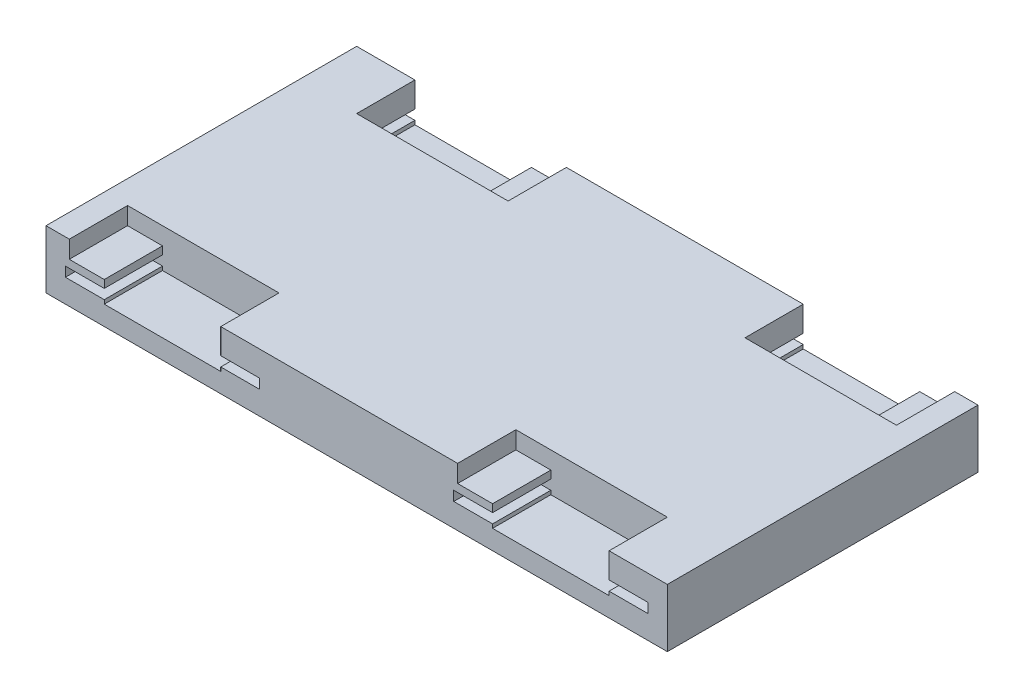
from build123d import *

# Parameters (mm, degrees)
SKETCH1_W               = 320
SKETCH1_H               = 160
BOSS_EXTRUDE1_DEPTH     = 20
SKETCH2_W               = 60
SKETCH2_H               = 30
CUT_EXTRUDE1_DEPTH      = 28
SKETCH3_W               = 20
SKETCH3_H               = 5
CUT_EXTRUDE3_DEPTH      = 30
MIRROR3_COPY_1_SKETCH_W = 60
MIRROR3_COPY_1_SKETCH_H = 30
MIRROR3_COPY_1_DEPTH    = 28
MIRROR3_COPY_2_SKETCH_W = 20
MIRROR3_COPY_2_SKETCH_H = 5
MIRROR3_COPY_2_DEPTH    = 30
SKETCH5_W               = 18
SKETCH5_H               = 9
CUT_EXTRUDE4_DEPTH      = 30
SKETCH6_W               = 18
SKETCH6_H               = 9
CUT_EXTRUDE5_DEPTH      = 30
SKETCH8_W               = 18
SKETCH8_H               = 9
CUT_EXTRUDE6_DEPTH      = 30
SKETCH9_W               = 18
SKETCH9_H               = 9
CUT_EXTRUDE7_DEPTH      = 30
SKETCH10_W              = 320
SKETCH10_H              = 160
BOSS_EXTRUDE2_DEPTH     = 10


with BuildPart() as part:
    # Sketch1 → Boss-Extrude1 (new body)
    with BuildSketch(Plane(origin=(0, 0, 0), x_dir=(1, 0, 0), z_dir=(0, 1, 0))):
        Rectangle(SKETCH1_W, SKETCH1_H)
    extrude(amount=BOSS_EXTRUDE1_DEPTH)

    # Sketch2 → Cut-Extrude1 (cut)
    with BuildSketch(Plane(origin=(0, 20, 0), x_dir=(1, 0, 0), z_dir=(0, 1, 0))):
        with Locations((-100, -65)):
            Rectangle(SKETCH2_W, SKETCH2_H)
    cut_extrude1 = extrude(amount=-CUT_EXTRUDE1_DEPTH, mode=Mode.SUBTRACT)

    # Sketch3 → Cut-Extrude3 (cut)
    with BuildSketch(Plane.XY.offset(80)):
        with Locations((-140, 4.5)):
            Rectangle(SKETCH3_W, SKETCH3_H)
        with Locations((-60, 4.5)):
            Rectangle(SKETCH3_W, SKETCH3_H)
    cut_extrude3 = extrude(amount=-CUT_EXTRUDE3_DEPTH, mode=Mode.SUBTRACT)

    # Mirror2: Cut-Extrude1, Cut-Extrude3 across plane
    add(cut_extrude1.mirror(Plane(origin=(0, 0, 0), x_dir=(0, 0, 1), z_dir=(1, 0, 0))), mode=Mode.SUBTRACT)
    add(cut_extrude3.mirror(Plane(origin=(0, 0, 0), x_dir=(0, 0, 1), z_dir=(1, 0, 0))), mode=Mode.SUBTRACT)

    # Mirror3: Cut-Extrude1, Cut-Extrude3 across plane
    add(cut_extrude1.mirror(Plane.XY), mode=Mode.SUBTRACT)
    add(cut_extrude3.mirror(Plane.XY), mode=Mode.SUBTRACT)

    # Mirror3 copy 1 sketch → Mirror3 copy 1 (cut)
    with BuildSketch(Plane(origin=(0, 20, 0), x_dir=(-1, 0, 0), z_dir=(0, 1, 0))):
        with Locations((-100, -65)):
            Rectangle(MIRROR3_COPY_1_SKETCH_W, MIRROR3_COPY_1_SKETCH_H)
    extrude(amount=-MIRROR3_COPY_1_DEPTH, mode=Mode.SUBTRACT)

    # Mirror3 copy 2 sketch → Mirror3 copy 2 (cut)
    with BuildSketch(Plane(origin=(0, 0, -80), x_dir=(-1, 0, 0), z_dir=(0, 0, -1))):
        with Locations((-140, 4.5)):
            Rectangle(MIRROR3_COPY_2_SKETCH_W, MIRROR3_COPY_2_SKETCH_H)
        with Locations((-60, 4.5)):
            Rectangle(MIRROR3_COPY_2_SKETCH_W, MIRROR3_COPY_2_SKETCH_H)
    extrude(amount=-MIRROR3_COPY_2_DEPTH, mode=Mode.SUBTRACT)

    # Sketch5 → Cut-Extrude4 (cut)
    with BuildSketch(Plane.XY.offset(80)):
        with Locations((-139, 15.5)):
            Rectangle(SKETCH5_W, SKETCH5_H)
    extrude(amount=-CUT_EXTRUDE4_DEPTH, mode=Mode.SUBTRACT)

    # Sketch6 → Cut-Extrude5 (cut)
    with BuildSketch(Plane.XY.offset(80)):
        with Locations((61, 15.5)):
            Rectangle(SKETCH6_W, SKETCH6_H)
    extrude(amount=-CUT_EXTRUDE5_DEPTH, mode=Mode.SUBTRACT)

    # Sketch8 → Cut-Extrude6 (cut)
    with BuildSketch(Plane(origin=(0, 0, -80), x_dir=(-1, 0, 0), z_dir=(0, 0, -1))):
        with Locations((-139, 15.5)):
            Rectangle(SKETCH8_W, SKETCH8_H)
    extrude(amount=-CUT_EXTRUDE6_DEPTH, mode=Mode.SUBTRACT)

    # Sketch9 → Cut-Extrude7 (cut)
    with BuildSketch(Plane(origin=(0, 0, -80), x_dir=(-1, 0, 0), z_dir=(0, 0, -1))):
        with Locations((61, 15.5)):
            Rectangle(SKETCH9_W, SKETCH9_H)
    extrude(amount=-CUT_EXTRUDE7_DEPTH, mode=Mode.SUBTRACT)

    # Sketch10 → Boss-Extrude2 (add)
    with BuildSketch(Plane.XZ):
        Rectangle(SKETCH10_W, SKETCH10_H)
    extrude(amount=BOSS_EXTRUDE2_DEPTH)


solid = part.part
